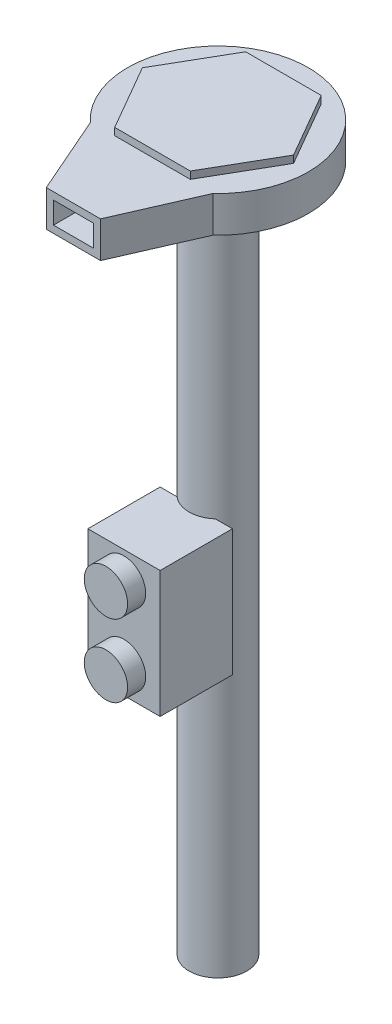
from build123d import *

# Parameters (mm, degrees)
SKETCH1_R            = 4
BOSS_EXTRUDE1_DEPTH  = 100
SKETCH2_R            = 3
CUT_EXTRUDE1_DEPTH   = 101.159872204
SKETCH3_R            = 12.5
BOSS_EXTRUDE2_DEPTH  = 5
SKETCH9_W            = 5.5
SKETCH9_H            = 3
CUT_EXTRUDE2_DEPTH   = 22.5
SKETCH2_2_R          = 3
CUT_EXTRUDE3_DEPTH   = 103.743612972
BOSS_EXTRUDE6_DEPTH  = 1
SKETCH18_W           = 10
SKETCH18_H           = 17.5
BOSS_EXTRUDE10_DEPTH = 10
SKETCH19_R           = 3
BOSS_EXTRUDE11_DEPTH = 2.5


with BuildPart() as part:
    # Sketch1 → Boss-Extrude1 (new body)
    with BuildSketch(Plane(origin=(0, 0, 0), x_dir=(1, 0, 0), z_dir=(0, 1, 0))):
        Circle(SKETCH1_R)
    extrude(amount=BOSS_EXTRUDE1_DEPTH)

    # Sketch2 → Cut-Extrude1 (cut, through all)
    with BuildSketch(Plane(origin=(0, 100, 0), x_dir=(1, 0, 0), z_dir=(0, 1, 0))):
        Circle(SKETCH2_R)
    extrude(amount=-CUT_EXTRUDE1_DEPTH, mode=Mode.SUBTRACT)

    # Sketch3 → Boss-Extrude2 (add)
    with BuildSketch(Plane(origin=(0, 100, 0), x_dir=(1, 0, 0), z_dir=(0, 1, 0))):
        Circle(SKETCH3_R)
    extrude(amount=-BOSS_EXTRUDE2_DEPTH)

    # Sketch5 → Loft2 section 0
    with BuildSketch(Plane.XY):
        with BuildLine():
            Line((-12.5, 100), (12.5, 100))
            Line((12.5, 100), (12.5, 95))
            Line((12.5, 95), (-12.5, 95))
            Line((-12.5, 95), (-12.5, 100))
        make_face()
    # Sketch4 → Loft2 section 1
    with BuildSketch(Plane.XY.offset(20)):
        with BuildLine():
            Line((-3.75, 100), (3.75, 100))
            Line((3.75, 100), (3.75, 95))
            Line((3.75, 95), (-3.75, 95))
            Line((-3.75, 95), (-3.75, 100))
        make_face()
    loft()

    # Sketch9 → Cut-Extrude2 (cut)
    with BuildSketch(Plane.XY.offset(20)):
        with Locations((0, 97.5)):
            Rectangle(SKETCH9_W, SKETCH9_H)
    extrude(amount=-CUT_EXTRUDE2_DEPTH, mode=Mode.SUBTRACT)

    # Sketch2<2> → Cut-Extrude3 (cut, through all)
    with BuildSketch(Plane(origin=(0, 100, 0), x_dir=(1, 0, 0), z_dir=(0, 1, 0))):
        Circle(SKETCH2_2_R)
    extrude(amount=-CUT_EXTRUDE3_DEPTH, mode=Mode.SUBTRACT)

    # Sketch14 → Boss-Extrude6 (add)
    with BuildSketch(Plane(origin=(0, 100, 0), x_dir=(1, 0, 0), z_dir=(0, 1, 0))):
        Polygon((10.456538619, 0), (5.22826931, 9.05562808), (-5.22826931, 9.05562808), (-10.456538619, 0), (-5.22826931, -9.05562808), (5.22826931, -9.05562808), align=None)
    extrude(amount=BOSS_EXTRUDE6_DEPTH)

    # Sketch18 → Boss-Extrude10 (add)
    with BuildSketch(Plane.XY.offset(3)):
        with Locations((0, 46.25)):
            Rectangle(SKETCH18_W, SKETCH18_H)
    extrude(amount=BOSS_EXTRUDE10_DEPTH)

    # Sketch19 → Boss-Extrude11 (add)
    with BuildSketch(Plane.XY.offset(13)):
        with Locations((0, 51.25)):
            Circle(SKETCH19_R)
        with Locations((0, 41.25)):
            Circle(SKETCH19_R)
    extrude(amount=BOSS_EXTRUDE11_DEPTH)


solid = part.part
